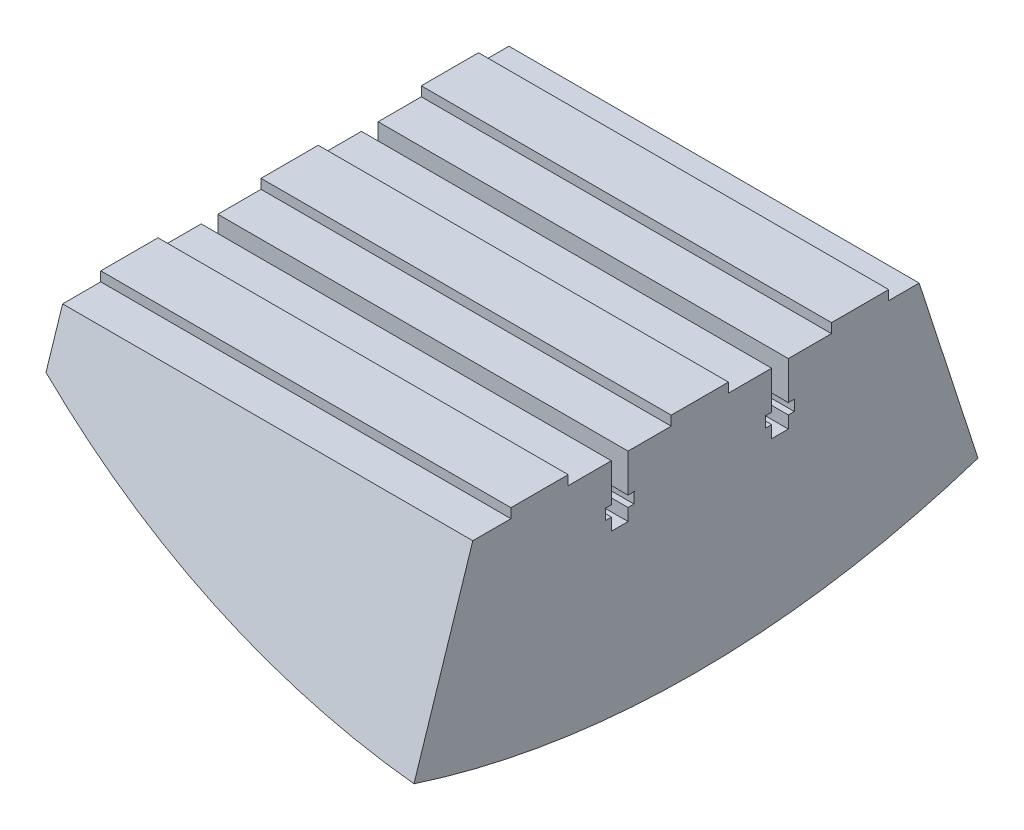
from build123d import *

# Parameters (mm, degrees)
REVOLVE1_ANGLE      = 36
SKETCH2_W           = 185.252199215
SKETCH2_H           = 56.371609172
CUT_EXTRUDE1_DEPTH  = 365.059347887
SKETCH5_W           = 55.655123519
SKETCH5_H           = 148.553285118
CUT_EXTRUDE2_DEPTH  = 235.735844279
SKETCH6_W           = 162.024812579
SKETCH6_H           = 19.05
BOSS_EXTRUDE1_DEPTH = 3.175
LPATTERN1_COUNT     = 3
LPATTERN1_PITCH     = 53.34
CUT_EXTRUDE3_DEPTH  = 357.818950588
LPATTERN2_COUNT     = 2
LPATTERN2_PITCH     = 53.34
SKETCH8_W           = 53.705765401
SKETCH8_H           = 196.003453697
CUT_EXTRUDE4_DEPTH  = 224.765760383


with BuildPart() as part:
    # Sketch1 → Revolve1 (revolve, symmetric)
    with BuildSketch(Plane.XY) as revolve1_sk:
        with BuildLine():
            Line((-202.80204389, -227.539822875), (-25.4, -227.539822875))
            Line((-25.4, -227.539822875), (-25.4, -303.739822875))
            ThreePointArc((-25.4, -303.739822875), (-120.294028152, -280.057827584), (-202.80204389, -227.539822875))
        make_face()
    revolve(axis=Axis((0, 0, 0), (-1, 0, 0)), revolution_arc=REVOLVE1_ANGLE / 2)
    revolve(revolve1_sk.sketch, axis=Axis((0, 0, 0), (1, 0, 0)), revolution_arc=REVOLVE1_ANGLE / 2)

    # Sketch2 → Cut-Extrude1 (cut, through all)
    with BuildSketch(Plane(origin=(-25.4, 0, 0), x_dir=(0, 0, -1), z_dir=(1, 0, 0))):
        with Locations((3.182919918, -200.414195414)):
            Rectangle(SKETCH2_W, SKETCH2_H)
    extrude(amount=-CUT_EXTRUDE1_DEPTH, mode=Mode.SUBTRACT)

    # Sketch5 → Cut-Extrude2 (cut, through all)
    with BuildSketch(Plane(origin=(0, -228.6, 0), x_dir=(1, 0, 0), z_dir=(0, 1, 0))):
        with Locations((-215.252374339, 0)):
            Rectangle(SKETCH5_W, SKETCH5_H)
    extrude(amount=-CUT_EXTRUDE2_DEPTH, mode=Mode.SUBTRACT)

    # Sketch6 → Boss-Extrude1 (add)
    with BuildSketch(Plane(origin=(0, -228.6, 0), x_dir=(1, 0, 0), z_dir=(0, 1, 0))):
        with Locations((-106.41240629, -52.051642559)):
            Rectangle(SKETCH6_W, SKETCH6_H)
    boss_extrude1 = extrude(amount=BOSS_EXTRUDE1_DEPTH)

    # LPattern1: Boss-Extrude1 ×3
    with Locations(*[(0, 0, -i * LPATTERN1_PITCH) for i in range(1, LPATTERN1_COUNT)]):
        add(boss_extrude1)

    # Sketch7 → Cut-Extrude3 (cut, through all)
    with BuildSketch(Plane(origin=(-25.4, 0, 0), x_dir=(0, 0, -1), z_dir=(1, 0, 0))):
        with BuildLine():
            Line((-22.603517559, -244.856), (-22.603517559, -248.92))
            Line((-22.603517559, -248.92), (-28.159767559, -248.92))
            Line((-28.159767559, -248.92), (-28.159767559, -244.856))
            Line((-28.159767559, -244.856), (-30.144142559, -244.856))
            Line((-30.144142559, -244.856), (-30.144142559, -241.427))
            ThreePointArc((-30.144142559, -241.427), (-30.23394512, -241.210197439), (-30.017142559, -241.3))
            Line((-30.017142559, -241.3), (-28.159767559, -241.3))
            Line((-28.159767559, -241.3), (-28.159767559, -228.6))
            Line((-28.159767559, -228.6), (-22.603517559, -228.6))
            Line((-22.603517559, -228.6), (-22.603517559, -241.3))
            Line((-22.603517559, -241.3), (-20.746142559, -241.3))
            ThreePointArc((-20.746142559, -241.3), (-20.529339998, -241.210197439), (-20.619142559, -241.427))
            Line((-20.619142559, -241.427), (-20.619142559, -244.856))
            Line((-20.619142559, -244.856), (-22.603517559, -244.856))
        make_face()
    cut_extrude3 = extrude(amount=-CUT_EXTRUDE3_DEPTH, mode=Mode.SUBTRACT)

    # LPattern2: Cut-Extrude3 ×2
    with Locations(*[(0, 0, -i * LPATTERN2_PITCH) for i in range(1, LPATTERN2_COUNT)]):
        add(cut_extrude3, mode=Mode.SUBTRACT)

    # Sketch8 → Cut-Extrude4 (cut, through all)
    with BuildSketch(Plane(origin=(0, -225.425, 0), x_dir=(1, 0, 0), z_dir=(0, 1, 0))):
        with Locations((-188.777882701, -12.617417505)):
            Rectangle(SKETCH8_W, SKETCH8_H)
    extrude(amount=-CUT_EXTRUDE4_DEPTH, mode=Mode.SUBTRACT)


solid = part.part
